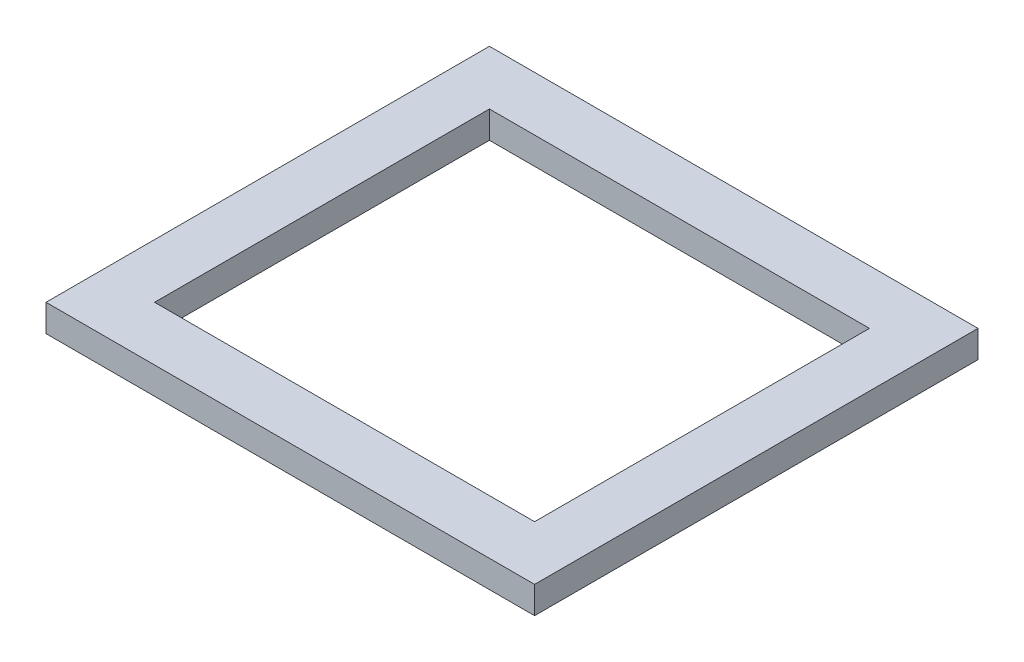
from build123d import *

# Parameters (mm, degrees)
SKETCH1_W           = 57.15
SKETCH1_H           = 51.8668
SKETCH1_W_2         = 44.45
SKETCH1_H_2         = 39.1668
BOSS_EXTRUDE1_DEPTH = 3.175


with BuildPart() as part:
    # Sketch1 → Boss-Extrude1 (new body)
    with BuildSketch(Plane(origin=(0, 0, 0), x_dir=(1, 0, 0), z_dir=(0, 1, 0))):
        with Locations((22.225, 19.5834)):
            Rectangle(SKETCH1_W, SKETCH1_H)
        with Locations((22.225, 19.5834)):
            Rectangle(SKETCH1_W_2, SKETCH1_H_2, mode=Mode.SUBTRACT)
    extrude(amount=BOSS_EXTRUDE1_DEPTH)


solid = part.part
